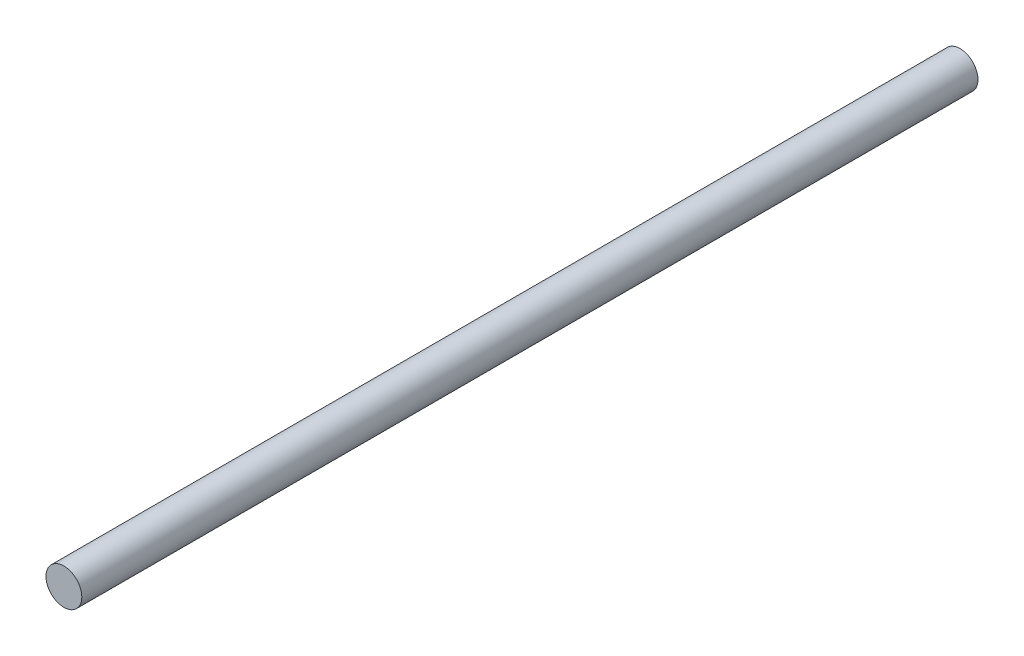
from build123d import *

# Parameters (mm, degrees)
SKETCH_1_R      = 10
EXTRUDE_1_DEPTH = 500


with BuildPart() as part:
    # 草图1 → 凸台-拉伸1 (new body)
    with BuildSketch(Plane.XY):
        Circle(SKETCH_1_R)
    extrude(amount=EXTRUDE_1_DEPTH)


solid = part.part
